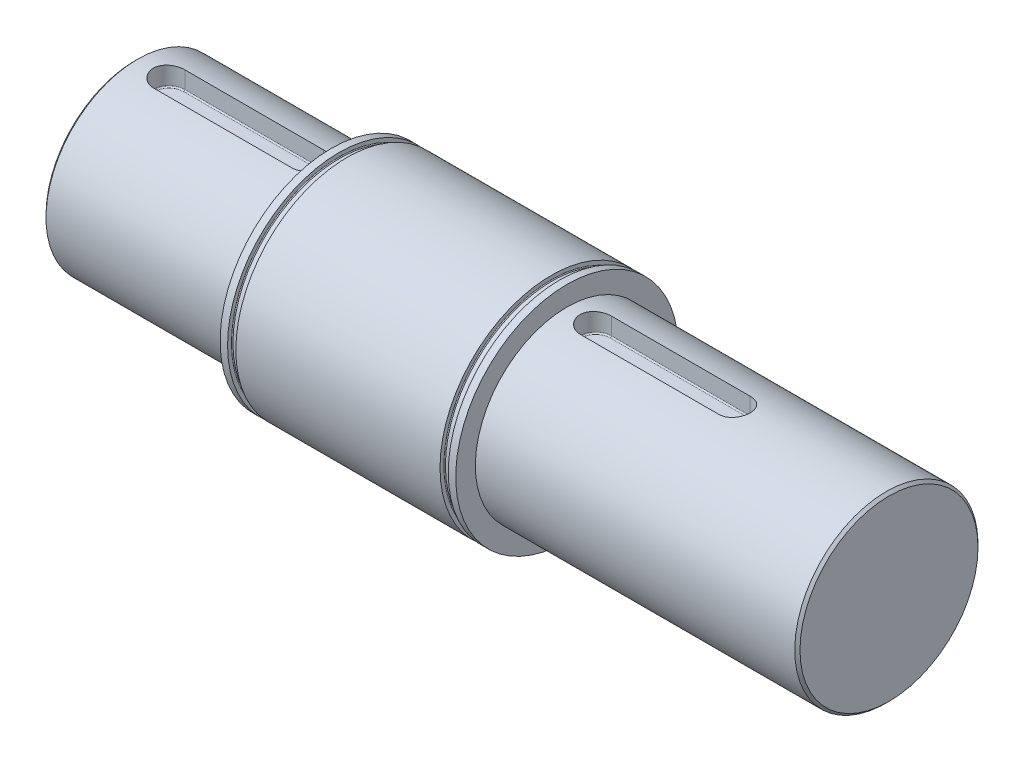
from build123d import *

# Parameters (mm, degrees)
SKETCH3_W               = 3.15
SKETCH3_H               = 1.75
FILLET1_R               = 0.3
CHAMFER1_SIZE           = 1
CUT_EXTRUDE1_REACH      = 185.54
CUT_EXTRUDE1_END_RADIUS = 35
CUT_EXTRUDE1_START      = 27.5
FILLET2_R               = 0.5


with BuildPart() as part:
    # Sketch1 → Revolve1 (revolve)
    with BuildSketch(Plane.XY):
        Polygon((144, 0), (144, 35), (21, 35), (21, 42.5), (-69, 42.5), (-69, 35), (-144, 35), (-144, 0), align=None)
    revolve(axis=Axis((144, 0, 0), (-1, 0, 0)))

    # Sketch3 → Cut-Revolve4 (revolve, cut)
    with BuildSketch(Plane.XY, mode=Mode.PRIVATE) as cut_revolve4_sk:
        with Locations((-64.575, 41.625)):
            Rectangle(SKETCH3_W, SKETCH3_H)
        with Locations((16.575, 41.625)):
            Rectangle(SKETCH3_W, SKETCH3_H)
    revolve(cut_revolve4_sk.sketch.rotate(Axis((9.271510533, 0, 0), (1, 0, 0)), 90), axis=Axis((9.271510533, 0, 0), (1, 0, 0)), mode=Mode.SUBTRACT)

    # Fillet1
    fillet1_edges = [part.edges().sort_by_distance(p)[0] for p in [
        (-66.15, 0, -40.75),
        (-63, 0, -40.75),
        (15, 0, -40.75),
        (18.15, 0, -40.75),
    ]]
    fillet(fillet1_edges, radius=FILLET1_R)

    # Chamfer1
    chamfer1_edges = [part.edges().sort_by_distance(p)[0] for p in [
        (-144, -35, 0),
        (144, -35, 0),
    ]]
    chamfer(chamfer1_edges, length=CHAMFER1_SIZE)

    # Cut-Extrude1: up to this cylinder (the profile starts inside it)
    cut_extrude1_end = Plane(origin=(-23, 0, 0), z_dir=(1, 0, 0)) * Cylinder(CUT_EXTRUDE1_END_RADIUS, 605.08, mode=Mode.PRIVATE)
    # Sketch4 → Cut-Extrude1 (cut, up to the surface)
    with BuildSketch(Plane(origin=(0, 0, 0), x_dir=(1, 0, 0), z_dir=(0, 1, 0)).offset(CUT_EXTRUDE1_START), mode=Mode.PRIVATE) as cut_extrude1_sk1:
        with BuildLine():
            Line((32, 6), (85, 6))
            ThreePointArc((85, 6), (91, 0), (85, -6))
            Line((85, -6), (32, -6))
            ThreePointArc((32, -6), (26, 0), (32, 6))
        make_face()
    cut_extrude1_tool1 = extrude(cut_extrude1_sk1.sketch, amount=CUT_EXTRUDE1_REACH, mode=Mode.PRIVATE) & cut_extrude1_end
    add(cut_extrude1_tool1.solids().sort_by_distance((58.5, 27.5, 0))[0], mode=Mode.SUBTRACT)
    # Sketch4 → Cut-Extrude1 (cut, up to the surface)
    with BuildSketch(Plane(origin=(0, 0, 0), x_dir=(1, 0, 0), z_dir=(0, 1, 0)).offset(CUT_EXTRUDE1_START), mode=Mode.PRIVATE) as cut_extrude1_sk2:
        with BuildLine():
            Line((-131, 6), (-78, 6))
            ThreePointArc((-78, 6), (-72, 0), (-78, -6))
            Line((-78, -6), (-131, -6))
            ThreePointArc((-131, -6), (-137, 0), (-131, 6))
        make_face()
    cut_extrude1_tool2 = extrude(cut_extrude1_sk2.sketch, amount=CUT_EXTRUDE1_REACH, mode=Mode.PRIVATE) & cut_extrude1_end
    add(cut_extrude1_tool2.solids().sort_by_distance((-104.5, 27.5, 0))[0], mode=Mode.SUBTRACT)

    # Fillet2
    fillet2_edges = [part.edges().sort_by_distance(p)[0] for p in [
        (26, 27.5, 0),
        (58.5, 27.5, 6),
        (91, 27.5, 0),
        (58.5, 27.5, -6),
        (-137, 27.5, 0),
        (-104.5, 27.5, 6),
        (-72, 27.5, 0),
        (-104.5, 27.5, -6),
    ]]
    fillet(fillet2_edges, radius=FILLET2_R)


solid = part.part
